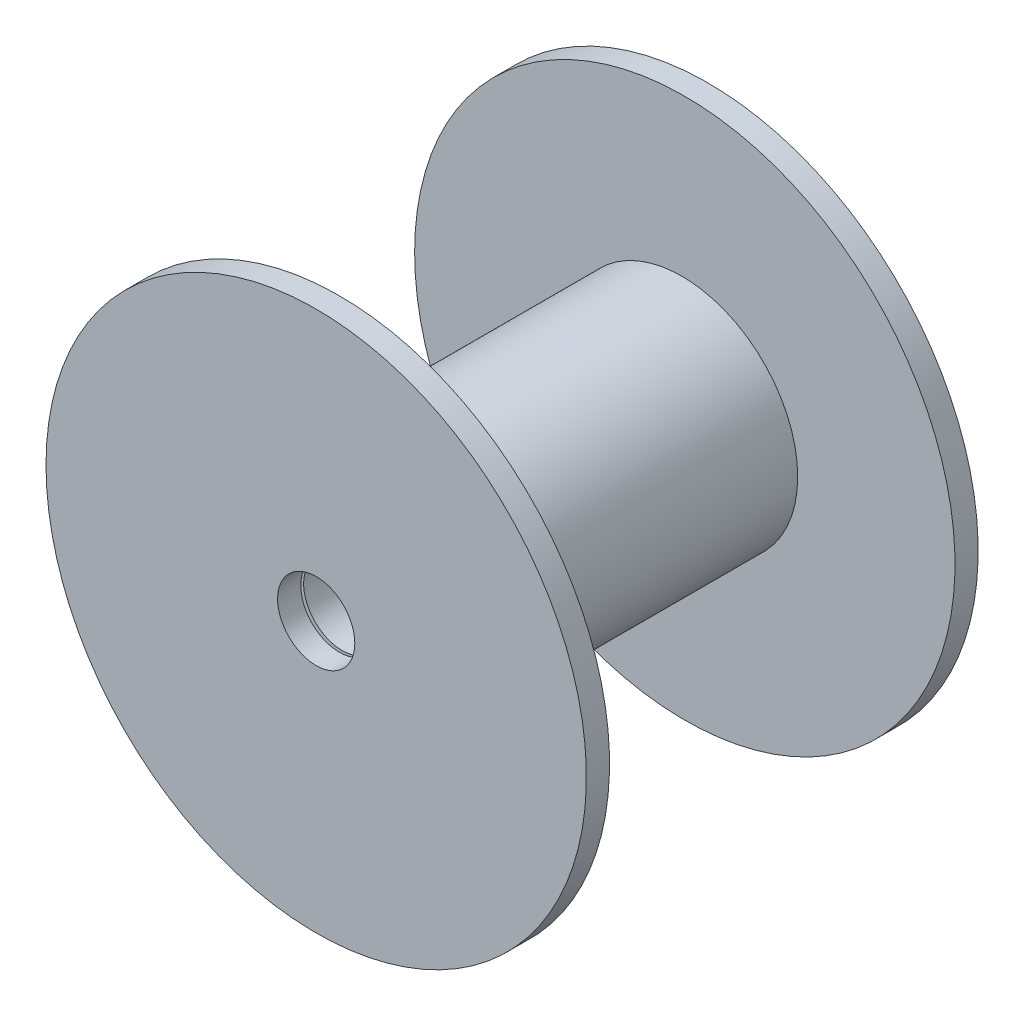
from build123d import *

# Parameters (mm, degrees)
ESQUISSE1_R                  = 15
ESQUISSE1_R_2                = 5
BOSS_EXTRU_1_DEPTH           = 44
ESQUISSE2_W                  = 3
ESQUISSE2_H                  = 35
ENL_V_MAT_EXTRU_2_DEPTH      = 64
ENL_V_MAT_EXTRU_2_DEPTH_BACK = 0.374681
ESQUISSE3_R                  = 5
ESQUISSE5_R                  = 5
ENL_V_MAT_EXTRU_3_DEPTH      = 71.890745446


with BuildPart() as part:
    # Esquisse1 → Boss.-Extru.1 (new body)
    with BuildSketch(Plane.XY):
        Circle(ESQUISSE1_R)
        Circle(ESQUISSE1_R_2, mode=Mode.SUBTRACT)
    extrude(amount=BOSS_EXTRU_1_DEPTH)


with BuildPart() as body_2:
    # Esquisse2 → Révolution3 (revolve)
    with BuildSketch(Plane(origin=(0, 0, 0), x_dir=(0, 0, -1), z_dir=(1, 0, 0)), mode=Mode.PRIVATE) as r_volution3_sk:
        with Locations((1.874681229, 17.5)):
            Rectangle(ESQUISSE2_W, ESQUISSE2_H)
        with Locations((-45.874681229, 17.5)):
            Rectangle(ESQUISSE2_W, ESQUISSE2_H)
    revolve(r_volution3_sk.sketch.rotate(Axis((0, 0, 44.374681229), (0, 0, 1)), 90), axis=Axis((0, 0, 44.374681229), (0, 0, 1)))

    # Esquisse3 → Enlèv. mat.-Extru.2 (cut, two sides: drawn at the far end of the back side and taken through both)
    with BuildSketch(Plane.XY.offset(-ENL_V_MAT_EXTRU_2_DEPTH_BACK)):
        Circle(ESQUISSE3_R)
    extrude(amount=ENL_V_MAT_EXTRU_2_DEPTH + ENL_V_MAT_EXTRU_2_DEPTH_BACK, mode=Mode.SUBTRACT)

    # Esquisse5 → Enlèv. mat.-Extru.3 (cut, through all)
    with BuildSketch(Plane(origin=(0, 0, -3.374681229), x_dir=(-1, 0, 0), z_dir=(0, 0, -1))):
        with Locations(Location((0, 0, 0), (0, 0, 180))):
            Circle(ESQUISSE5_R)
    extrude(amount=-ENL_V_MAT_EXTRU_3_DEPTH, mode=Mode.SUBTRACT)


solid = Compound([part.part, body_2.part])
